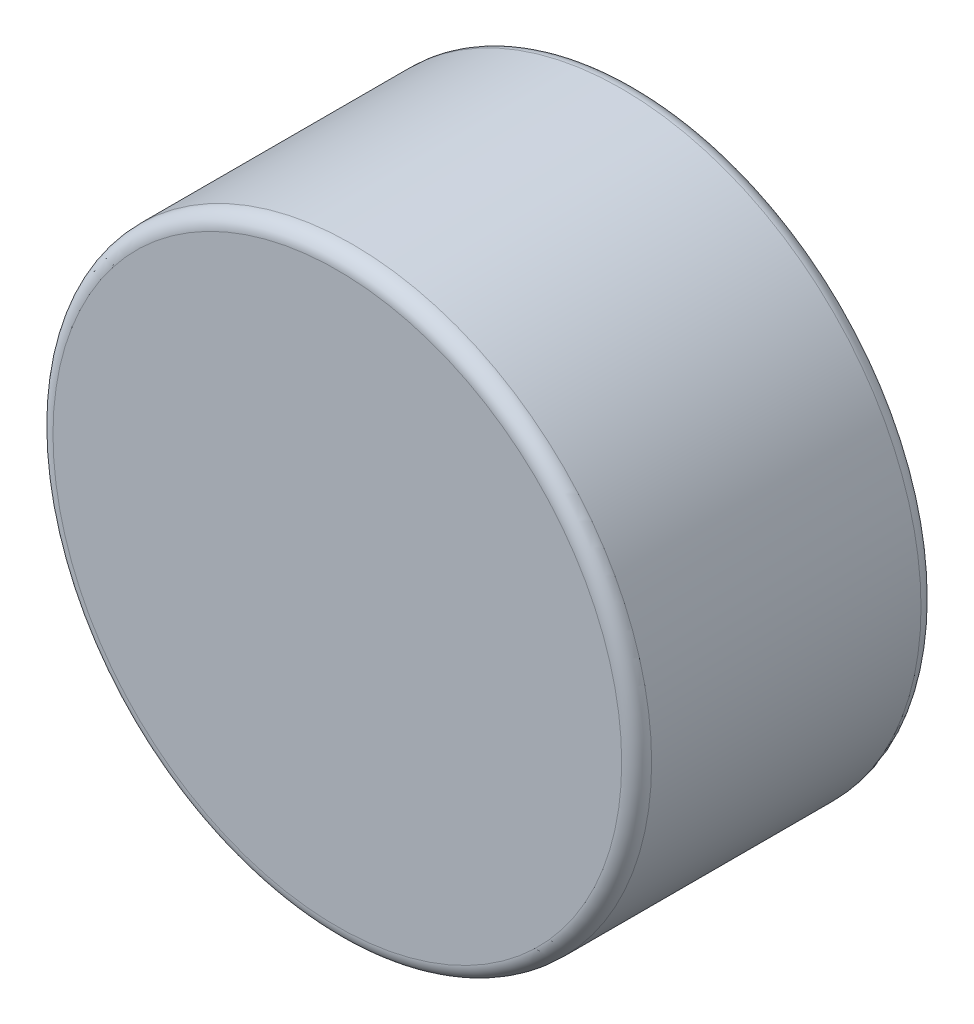
from build123d import *

# Parameters (mm, degrees)
SKETCH1_W = 2
SKETCH1_H = 2
FILLET1_R = 0.1


with BuildPart() as part:
    # Sketch1 → Revolve1 (revolve)
    with BuildSketch(Plane(origin=(0, 0, 0), x_dir=(0, 0, -1), z_dir=(1, 0, 0)), mode=Mode.PRIVATE) as revolve1_sk:
        with Locations((1, 1)):
            Rectangle(SKETCH1_W, SKETCH1_H)
    revolve(revolve1_sk.sketch.rotate(Axis((0, 0, 9.214007782), (0, 0, -1)), 90), axis=Axis((0, 0, 9.214007782), (0, 0, -1)))

    # Fillet1
    fillet1_edges = [part.edges().sort_by_distance(p)[0] for p in [
        (-2, 0, -2),
        (-2, 0, 0),
    ]]
    fillet(fillet1_edges, radius=FILLET1_R)


solid = part.part
